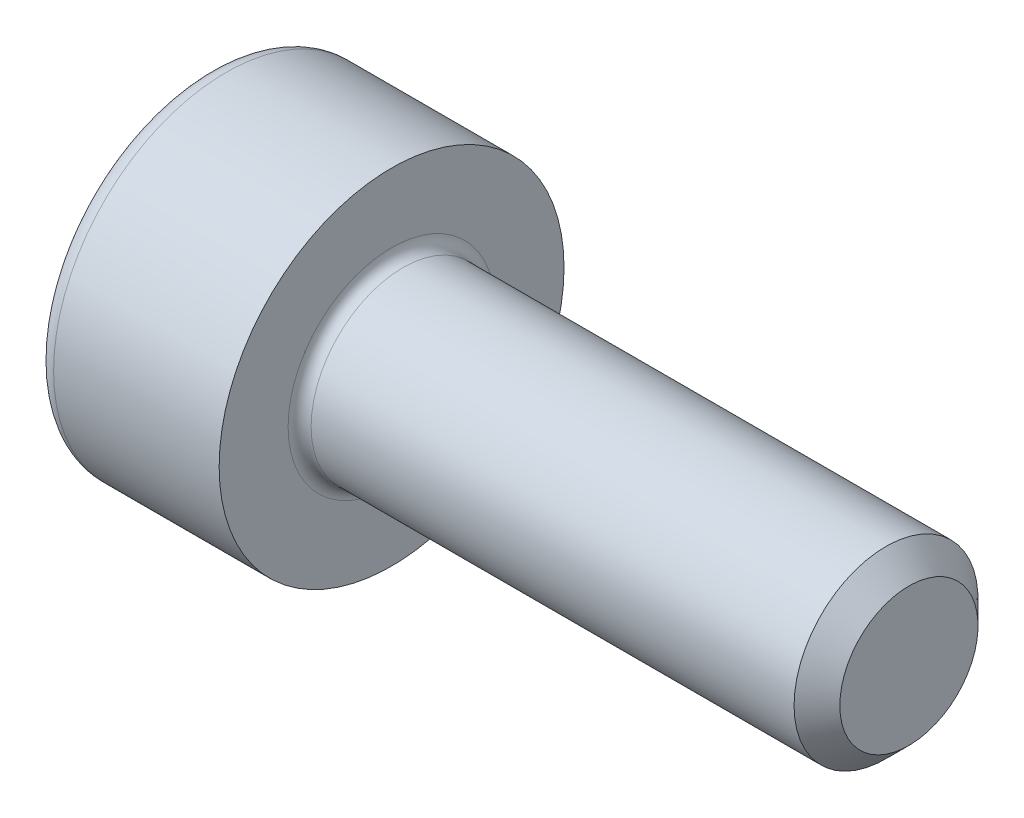
from build123d import *

# Parameters (mm, degrees)
FILLET1_R   = 0.1
FILLET2_R   = 0.16
HEX_2_DEPTH = 0.7


with BuildPart() as part:
    # BodySke → Base-Revolve (revolve)
    with BuildSketch(Plane.XY, mode=Mode.PRIVATE) as base_revolve_sk:
        Polygon((0, 0), (0, 1.5), (1.6, 1.5), (1.6, 0.8), (5.901, 0.8), (6.1, 0.601), (6.1, 0), align=None)
    revolve(base_revolve_sk.sketch.rotate(Axis((-31.75, 0, 0), (1, 0, 0)), 90), axis=Axis((-31.75, 0, 0), (1, 0, 0)))

    # Fillet1
    fillet1_edges = [part.edges().sort_by_distance(p)[0] for p in [
        (1.6, 0, -0.8),
    ]]
    fillet(fillet1_edges, radius=FILLET1_R)

    # Fillet2
    fillet2_edges = [part.edges().sort_by_distance(p)[0] for p in [
        (0, 0, -1.5),
    ]]
    fillet(fillet2_edges, radius=FILLET2_R)

    # Sketch2 → Hex-PreBroach (revolve, cut)
    with BuildSketch(Plane.XY, mode=Mode.PRIVATE) as hex_prebroach_sk:
        Polygon((0, 0.76), (0.7, 0.76), (1.138786205, 0), (0, 0), align=None)
    revolve(hex_prebroach_sk.sketch.rotate(Axis((0, 0, 0), (1, 0, 0)), 90), axis=Axis((0, 0, 0), (1, 0, 0)), mode=Mode.SUBTRACT)

    # Sketch3 → Hex 2 (cut)
    with BuildSketch(Plane(origin=(0, 0, 0), x_dir=(0, 0.500000000000001, 0.866025403784438), z_dir=(-1, 0, 0))):
        Polygon((0.438786205, 0.76), (-0.438786205, 0.76), (-0.877572409, 0), (-0.438786205, -0.76), (0.438786205, -0.76), (0.877572409, 0), align=None)
    extrude(amount=-HEX_2_DEPTH, mode=Mode.SUBTRACT)


solid = part.part
